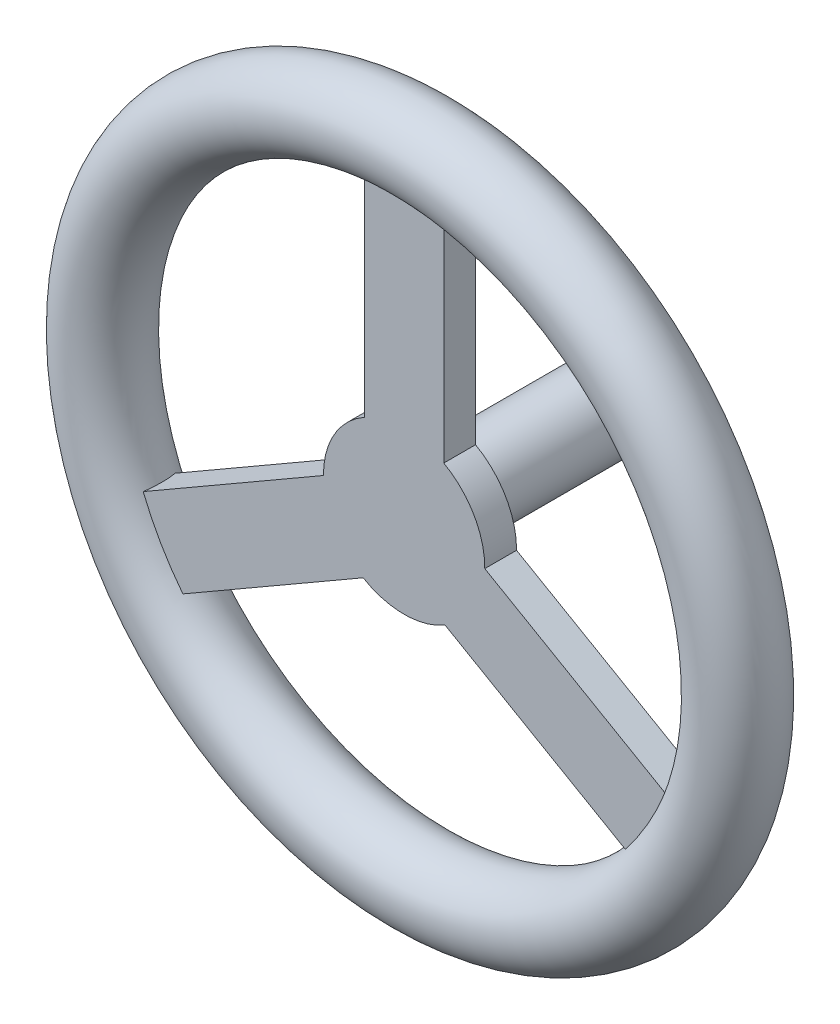
from build123d import *

# Parameters (mm, degrees)
SKETCH2_R           = 12.5
BOSS_EXTRUDE1_DEPTH = 5
SKETCH4_R           = 12.5
BOSS_EXTRUDE2_DEPTH = 50


with BuildPart() as part:
    # Sketch2 → Revolve1 (revolve)
    with BuildSketch(Plane(origin=(0, 0, 0), x_dir=(1, 0, 0), z_dir=(0, 1, 0)), mode=Mode.PRIVATE) as revolve1_sk:
        with Locations((100, 0)):
            Circle(SKETCH2_R)
    revolve(revolve1_sk.sketch.rotate(Axis((0, 0, 0), (0, 0, 1)), 180), axis=Axis((0, 0, 0), (0, 0, 1)))

    # Sketch3 → Boss-Extrude1 (add, symmetric)
    with BuildSketch(Plane.XY):
        with BuildLine():
            Line((-73.52073385, -56.880972209), (-12.898955585, -21.880972209))
            ThreePointArc((-12.898955585, -21.880972209), (-21.997045256, -12.7), (-25.398955585, -0.230337114))
            Line((-25.398955585, -0.230337114), (-86.02073385, -35.230337114))
            Line((-86.02073385, -35.230337114), (-73.52073385, -56.880972209))
        make_face()
        with BuildLine():
            Line((-25.398955585, -0.230337114), (-12.898955585, -21.880972209))
            ThreePointArc((-12.898955585, -21.880972209), (0, -25.4), (12.898955585, -21.880972209))
            Line((12.898955585, -21.880972209), (25.398955585, -0.230337114))
            ThreePointArc((25.398955585, -0.230337114), (25.399738895, -0.115169741), (25.4, 0))
            ThreePointArc((25.4, 0), (21.939234262, 12.799609369), (12.5, 22.111309324))
            Line((12.5, 22.111309324), (-12.5, 22.111309324))
            ThreePointArc((-12.5, 22.111309324), (-21.997045256, 12.7), (-25.398955585, -0.230337114))
        make_face()
        with BuildLine():
            ThreePointArc((-25.398955585, -0.230337114), (-21.997045256, -12.7), (-12.898955585, -21.880972209))
            Line((-12.898955585, -21.880972209), (-25.398955585, -0.230337114))
        make_face()
        with BuildLine():
            ThreePointArc((12.5, 22.111309324), (0, 25.4), (-12.5, 22.111309324))
            Line((-12.5, 22.111309324), (12.5, 22.111309324))
        make_face()
        with BuildLine():
            Line((-12.5, 92.111309324), (-12.5, 22.111309324))
            ThreePointArc((-12.5, 22.111309324), (0, 25.4), (12.5, 22.111309324))
            Line((12.5, 22.111309324), (12.5, 92.111309324))
            Line((12.5, 92.111309324), (-12.5, 92.111309324))
        make_face()
        with BuildLine():
            Line((25.398955585, -0.230337114), (12.898955585, -21.880972209))
            ThreePointArc((12.898955585, -21.880972209), (21.997045256, -12.7), (25.398955585, -0.230337114))
        make_face()
        with BuildLine():
            ThreePointArc((25.398955585, -0.230337114), (21.997045256, -12.7), (12.898955585, -21.880972209))
            Line((12.898955585, -21.880972209), (73.52073385, -56.880972209))
            Line((73.52073385, -56.880972209), (86.02073385, -35.230337114))
            Line((86.02073385, -35.230337114), (25.398955585, -0.230337114))
        make_face()
    extrude(amount=BOSS_EXTRUDE1_DEPTH, both=True)

    # Sketch4 → Boss-Extrude2 (add)
    with BuildSketch(Plane(origin=(0, 0, -5), x_dir=(-1, 0, 0), z_dir=(0, 0, -1))):
        with Locations(Location((0, 0, 0), (0, 0, 180))):
            Circle(SKETCH4_R)
    extrude(amount=BOSS_EXTRUDE2_DEPTH)


solid = part.part
